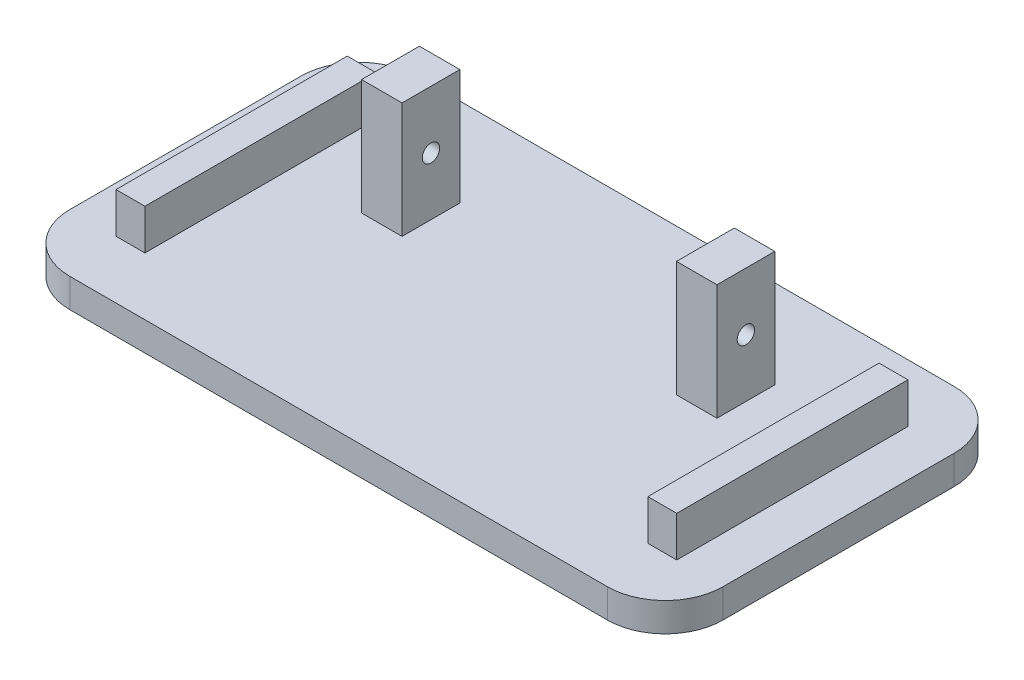
from build123d import *

# Parameters (mm, degrees)
RESSALTO_EXTRUS_O1_DEPTH = 5
ESBO_O2_W                = 7
ESBO_O2_H                = 10
RESSALTO_EXTRUS_O2_DEPTH = 20
ESBO_O4_R                = 1.5
CORTE_EXTRUS_O1_DEPTH    = 102.059937663
ESBO_O5_W                = 5
ESBO_O5_H                = 40
RESSALTO_EXTRUS_O3_DEPTH = 7


with BuildPart() as part:
    # Esboço1 → Ressalto-extrusão1 (new body)
    with BuildSketch(Plane(origin=(0, 0, 0), x_dir=(1, 0, 0), z_dir=(0, 1, 0))):
        with BuildLine():
            Line((-13.214501511, 15.533232628), (79.785498489, 15.533232628))
            ThreePointArc((79.785498489, 15.533232628), (86.856566301, 12.60430044), (89.785498489, 5.533232628))
            Line((89.785498489, 5.533232628), (89.785498489, -34.466767372))
            ThreePointArc((89.785498489, -34.466767372), (86.856566301, -41.537835183), (79.785498489, -44.466767372))
            Line((79.785498489, -44.466767372), (-13.214501511, -44.466767372))
            ThreePointArc((-13.214501511, -44.466767372), (-20.285569322, -41.537835183), (-23.214501511, -34.466767372))
            Line((-23.214501511, -34.466767372), (-23.214501511, 5.533232628))
            ThreePointArc((-23.214501511, 5.533232628), (-20.285569322, 12.60430044), (-13.214501511, 15.533232628))
        make_face()
    extrude(amount=RESSALTO_EXTRUS_O1_DEPTH)

    # Esboço2 → Ressalto-extrusão2 (add)
    with BuildSketch(Plane(origin=(0, 5, 0), x_dir=(1, 0, 0), z_dir=(0, 1, 0))):
        with Locations((60.525498489, -4.747557162)):
            Rectangle(ESBO_O2_W, ESBO_O2_H)
        with Locations((6.045498489, -4.747557162)):
            Rectangle(ESBO_O2_W, ESBO_O2_H)
    extrude(amount=RESSALTO_EXTRUS_O2_DEPTH)

    # Esboço4 → Corte-extrusão1 (cut, through all)
    with BuildSketch(Plane.ZY.offset(-2.545498489)):
        with Locations((4.747557162, 15)):
            Circle(ESBO_O4_R)
    extrude(amount=-CORTE_EXTRUS_O1_DEPTH, mode=Mode.SUBTRACT)

    # Esboço5 → Ressalto-extrusão3 (add)
    with BuildSketch(Plane(origin=(0, 5, 0), x_dir=(1, 0, 0), z_dir=(0, 1, 0))):
        with Locations((-12.714501511, -14.466767372)):
            Rectangle(ESBO_O5_W, ESBO_O5_H)
        with Locations((79.285498489, -14.466767372)):
            Rectangle(ESBO_O5_W, ESBO_O5_H)
    extrude(amount=RESSALTO_EXTRUS_O3_DEPTH)


solid = part.part
